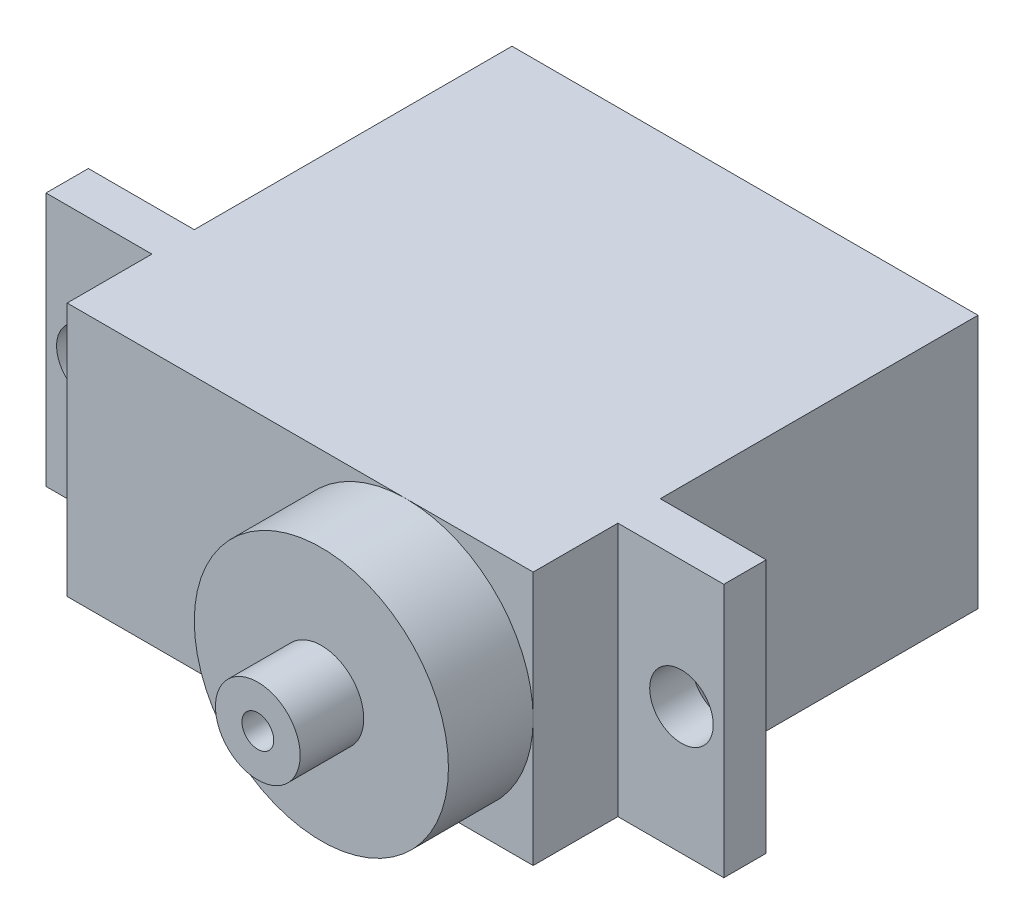
from build123d import *

# Parameters (mm, degrees)
CROQUIS1_W              = 32
CROQUIS1_H              = 12
SALIENTE_EXTRUIR1_DEPTH = 30
CROQUIS2_W              = 5
CROQUIS2_H              = 12
CORTAR_EXTRUIR1_DEPTH   = 15
CROQUIS3_W              = 32
CROQUIS3_H              = 12
CORTAR_EXTRUIR3_DEPTH   = 13
CROQUIS4_W              = 22
CROQUIS4_H              = 12
SALIENTE_EXTRUIR2_DEPTH = 4
CROQUIS5_R              = 6
SALIENTE_EXTRUIR3_DEPTH = 4
CROQUIS6_R              = 2
SALIENTE_EXTRUIR4_DEPTH = 3
CROQUIS7_R              = 0.75
CORTAR_EXTRUIR4_DEPTH   = 4
CROQUIS8_R              = 1.5
CORTAR_EXTRUIR5_DEPTH   = 4


with BuildPart() as part:
    # Croquis1 → Saliente-Extruir1 (new body)
    with BuildSketch(Plane.XY):
        Rectangle(CROQUIS1_W, CROQUIS1_H)
    extrude(amount=SALIENTE_EXTRUIR1_DEPTH)

    # Croquis2 → Cortar-Extruir1 (cut)
    with BuildSketch(Plane(origin=(0, 0, 0), x_dir=(-1, 0, 0), z_dir=(0, 0, -1))):
        with Locations((-13.5, 0)):
            Rectangle(CROQUIS2_W, CROQUIS2_H)
        with Locations((13.5, 0)):
            Rectangle(CROQUIS2_W, CROQUIS2_H)
    extrude(amount=-CORTAR_EXTRUIR1_DEPTH, mode=Mode.SUBTRACT)

    # Croquis3 → Cortar-Extruir3 (cut)
    with BuildSketch(Plane.XY.offset(30)):
        Rectangle(CROQUIS3_W, CROQUIS3_H)
    extrude(amount=-CORTAR_EXTRUIR3_DEPTH, mode=Mode.SUBTRACT)

    # Croquis4 → Saliente-Extruir2 (add)
    with BuildSketch(Plane.XY.offset(17)):
        Rectangle(CROQUIS4_W, CROQUIS4_H)
    extrude(amount=SALIENTE_EXTRUIR2_DEPTH)

    # Croquis5 → Saliente-Extruir3 (add)
    with BuildSketch(Plane.XY.offset(21)):
        with Locations((5, 0)):
            Circle(CROQUIS5_R)
    extrude(amount=SALIENTE_EXTRUIR3_DEPTH)

    # Croquis6 → Saliente-Extruir4 (add)
    with BuildSketch(Plane.XY.offset(25)):
        with Locations((5, 0)):
            Circle(CROQUIS6_R)
    extrude(amount=SALIENTE_EXTRUIR4_DEPTH)

    # Croquis7 → Cortar-Extruir4 (cut)
    with BuildSketch(Plane.XY.offset(28)):
        with Locations((5, 0)):
            Circle(CROQUIS7_R)
    extrude(amount=-CORTAR_EXTRUIR4_DEPTH, mode=Mode.SUBTRACT)

    # Croquis8 → Cortar-Extruir5 (cut)
    with BuildSketch(Plane.XY.offset(17)):
        with Locations((-14, 0)):
            Circle(CROQUIS8_R)
    cortar_extruir5 = extrude(amount=-CORTAR_EXTRUIR5_DEPTH, mode=Mode.SUBTRACT)

    # Simetría1: Cortar-Extruir5 across plane
    add(cortar_extruir5.mirror(Plane(origin=(0, 0, 0), x_dir=(0, 0, 1), z_dir=(1, 0, 0))), mode=Mode.SUBTRACT)


solid = part.part
